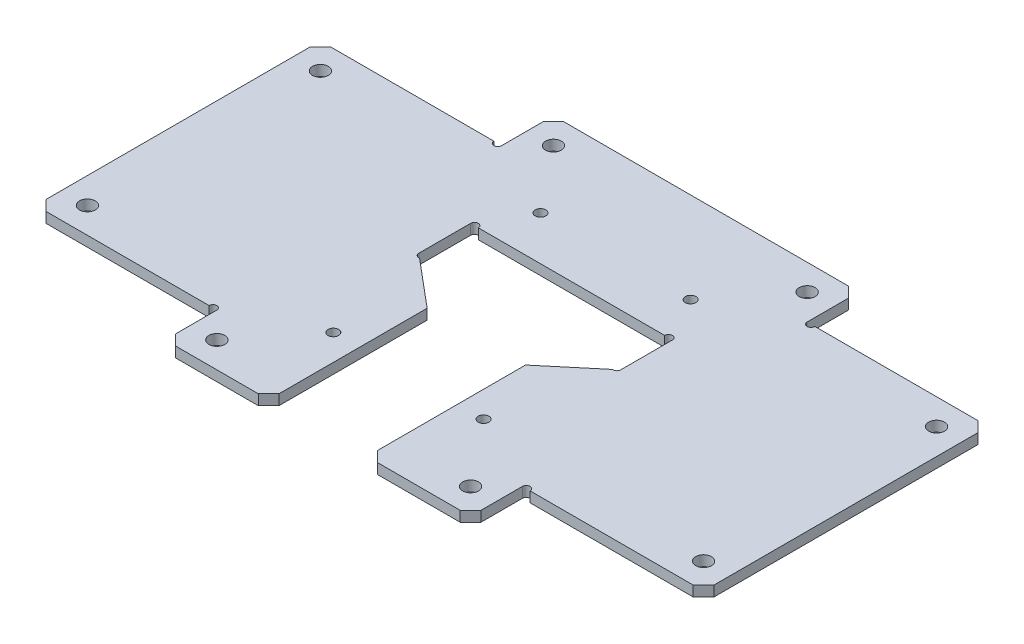
from build123d import *

# Parameters (mm, degrees)
SKETCH_1_R          = 3.05
EXTRUDE_1_DEPTH     = 2
CUT_EXTRUDE_1_DEPTH = 163.052460642
SKETCH_3_R          = 1.5
CUT_EXTRUDE_2_DEPTH = 163.052460642
SKETCH_4_R          = 2.05
CUT_EXTRUDE_3_DEPTH = 163.052460642
CHAMFER_1_SIZE      = 4


with BuildPart() as part:
    # 草图1 → 凸台-拉伸1 (new, symmetric)
    with BuildSketch(Plane(origin=(0, 0, 0), x_dir=(1, 0, 0), z_dir=(0, 1, 0))):
        Polygon((59, 52), (-59, 52), (-59, 32), (-129, 32), (-129, -78), (-59, -78), (-59, -98), (-19, -98), (-19, 0), (19, 0), (19, -98), (59, -98), (59, -78), (129, -78), (129, 32), (59, 32), align=None)
        with Locations(Location((-49, 42, 0), (0, 0, 270))):
            Circle(SKETCH_1_R, mode=Mode.SUBTRACT)
        with Locations(Location((-119, 22, 0), (0, 0, 270))):
            Circle(SKETCH_1_R, mode=Mode.SUBTRACT)
        with Locations(Location((-119, -68, 0), (0, 0, 270))):
            Circle(SKETCH_1_R, mode=Mode.SUBTRACT)
        with Locations(Location((-49, -88, 0), (0, 0, 270))):
            Circle(SKETCH_1_R, mode=Mode.SUBTRACT)
        with Locations(Location((49, -88, 0), (0, 0, 90))):
            Circle(SKETCH_1_R, mode=Mode.SUBTRACT)
        with Locations(Location((119, -68, 0), (0, 0, 90))):
            Circle(SKETCH_1_R, mode=Mode.SUBTRACT)
        with Locations(Location((119, 22, 0), (0, 0, 90))):
            Circle(SKETCH_1_R, mode=Mode.SUBTRACT)
        with Locations(Location((49, 42, 0), (0, 0, 90))):
            Circle(SKETCH_1_R, mode=Mode.SUBTRACT)
    extrude(amount=EXTRUDE_1_DEPTH, both=True)

    # 草图2 → 切除-拉伸1 (cut, through all)
    with BuildSketch(Plane(origin=(0, 2, 0), x_dir=(1, 0, 0), z_dir=(0, 1, 0))):
        Polygon((-19, 0), (-39, 0), (-39, -20), (-19, -36.781992624), align=None)
        Polygon((39, -20), (19, -36.781992624), (19, 0), (39, 0), align=None)
    extrude(amount=-CUT_EXTRUDE_1_DEPTH, mode=Mode.SUBTRACT)

    # 草图3 → 切除-拉伸2 (cut, through all)
    with BuildSketch(Plane(origin=(0, 2, 0), x_dir=(1, 0, 0), z_dir=(0, 1, 0))):
        with Locations((-37.5, 0)):
            Circle(SKETCH_3_R)
        with Locations((-37.5, -20)):
            Circle(SKETCH_3_R)
        with Locations((37.5, -20)):
            Circle(SKETCH_3_R)
        with Locations((37.5, 0)):
            Circle(SKETCH_3_R)
        with Locations((-60.5, 32)):
            Circle(SKETCH_3_R)
        with Locations((-60.5, -78)):
            Circle(SKETCH_3_R)
        with Locations((60.5, -78)):
            Circle(SKETCH_3_R)
        with Locations((60.5, 32)):
            Circle(SKETCH_3_R)
    extrude(amount=-CUT_EXTRUDE_2_DEPTH, mode=Mode.SUBTRACT)

    # 草图4 → 切除-拉伸3 (cut, through all)
    with BuildSketch(Plane(origin=(0, 2, 0), x_dir=(1, 0, 0), z_dir=(0, 1, 0))):
        with Locations(Location((-29, -63, 0), (0, 0, 270))):
            Circle(SKETCH_4_R)
        with Locations(Location((29, -63, 0), (0, 0, 270))):
            Circle(SKETCH_4_R)
        with Locations(Location((29, 17, 0), (0, 0, 270))):
            Circle(SKETCH_4_R)
        with Locations(Location((-29, 17, 0), (0, 0, 270))):
            Circle(SKETCH_4_R)
    extrude(amount=-CUT_EXTRUDE_3_DEPTH, mode=Mode.SUBTRACT)

    # 倒角1
    chamfer_1_edges = [part.edges().sort_by_distance(p)[0] for p in [
        (-129, 0, 78),
        (-129, 0, -32),
        (-59, 0, -52),
        (59, 0, -52),
        (129, 0, -32),
        (129, 0, 78),
        (59, 0, 98),
        (19, 0, 98),
        (-19, 0, 98),
        (-59, 0, 98),
    ]]
    chamfer(chamfer_1_edges, length=CHAMFER_1_SIZE)


solid = part.part
